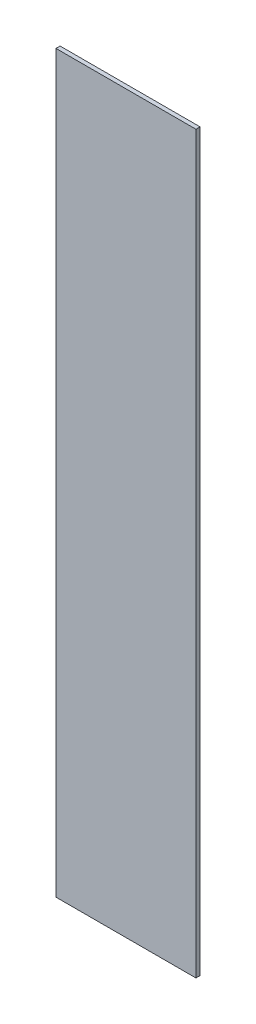
from build123d import *

# Parameters (mm, degrees)
SKETCH1_W           = 101.6
SKETCH1_H           = 533.4
BOSS_EXTRUDE1_DEPTH = 2.9972


with BuildPart() as part:
    # Sketch1 → Boss-Extrude1 (new body)
    with BuildSketch(Plane.XY):
        Rectangle(SKETCH1_W, SKETCH1_H)
    extrude(amount=BOSS_EXTRUDE1_DEPTH)


solid = part.part
